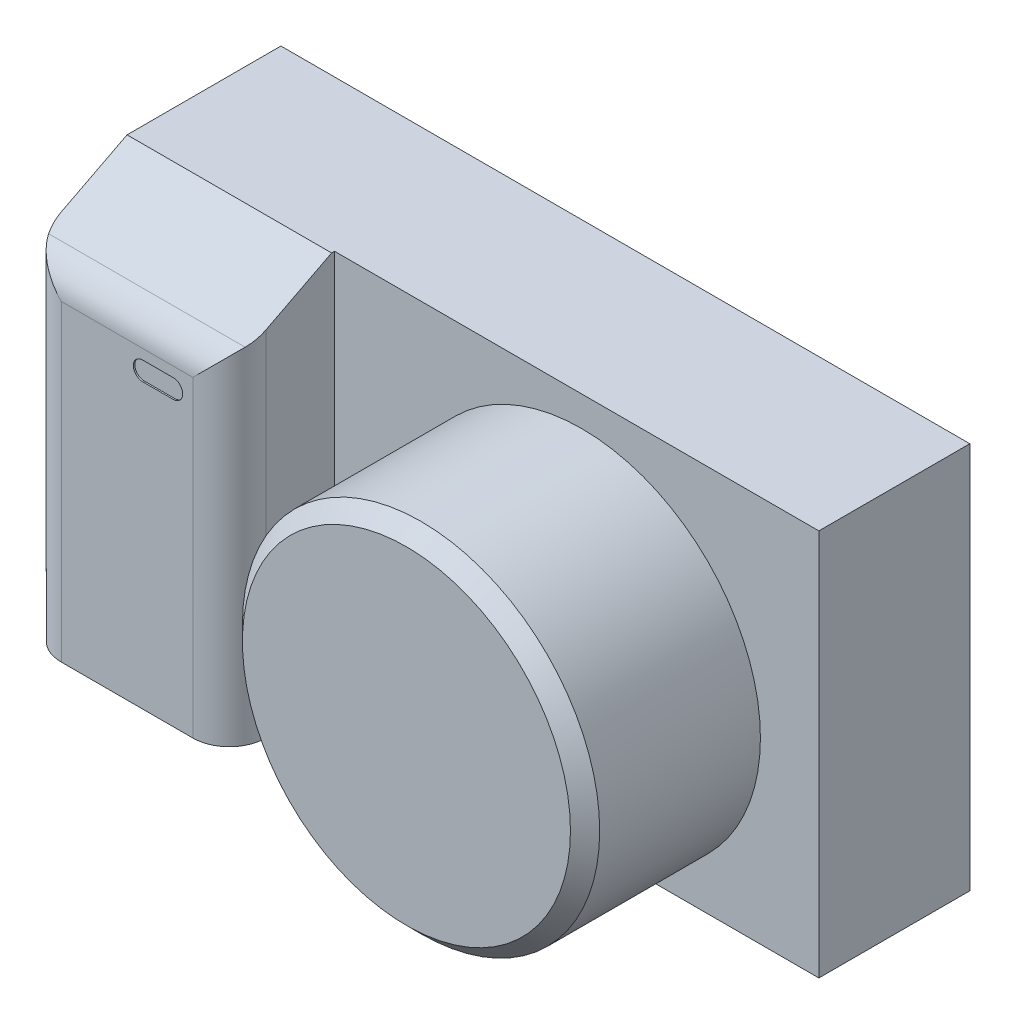
from build123d import *

# Parameters (mm, degrees)
SKETCH1_W                   = 119.7483
SKETCH1_H                   = 67.31
BOSS_EXTRUDE1_DEPTH         = 26.2382
SKETCH2_R                   = 31.0515
BOSS_EXTRUDE2_DEPTH         = 30.48
CHAMFER1_SIZE               = 2.54
SKETCH3_W                   = 35.56
SKETCH3_H                   = 67.31
BOSS_EXTRUDE3_DEPTH         = 18.288
CHAMFER2_SIZE               = 17.78
CHAMFER2_SIZE2              = 9.144
FILLET1_R                   = 6.35
CUT_EXTRUDE1_DEPTH          = 0.254
F_1_4_20_TAPPED_HOLE1_D     = 5.1054
F_1_4_20_TAPPED_HOLE1_DEPTH = 16.51
F_1_4_20_TAPPED_HOLE1_TIP   = 1.533816902


with BuildPart() as part:
    # Sketch1 → Boss-Extrude1 (new body)
    with BuildSketch(Plane.XY):
        Rectangle(SKETCH1_W, SKETCH1_H)
    extrude(amount=BOSS_EXTRUDE1_DEPTH)

    # Sketch2 → Boss-Extrude2 (add)
    with BuildSketch(Plane.XY.offset(26.2382)):
        with Locations(Location((18.66265, -2.6035, 0), (0, 0, 270))):
            Circle(SKETCH2_R)
    extrude(amount=BOSS_EXTRUDE2_DEPTH)

    # Chamfer1
    chamfer1_edges = [part.edges().sort_by_distance(p)[0] for p in [
        (18.66265, 28.448, 56.7182),
    ]]
    chamfer(chamfer1_edges, length=CHAMFER1_SIZE)

    # Sketch3 → Boss-Extrude3 (add)
    with BuildSketch(Plane.XY.offset(26.2382)):
        with Locations((-42.09415, 0)):
            Rectangle(SKETCH3_W, SKETCH3_H)
    extrude(amount=BOSS_EXTRUDE3_DEPTH)

    # Chamfer2
    chamfer2_edges = [part.edges().sort_by_distance(p)[0] for p in [
        (-42.09415, 33.655, 44.5262),
    ]]
    chamfer2_side = [part.faces().sort_by_distance(p)[0] for p in [
        (-7.218498902, 33.655, 16.936879024),
    ]]
    chamfer(chamfer2_edges, length=CHAMFER2_SIZE, length2=CHAMFER2_SIZE2, reference=chamfer2_side[0])

    # Fillet1
    fillet1_edges = [part.edges().sort_by_distance(p)[0] for p in [
        (-24.31415, -4.572, 44.5262),
        (-59.87415, -4.572, 44.5262),
        (-42.09415, 24.511, 44.5262),
    ]]
    fillet(fillet1_edges, radius=FILLET1_R)

    # Sketch4 → Cut-Extrude1 (cut)
    with BuildSketch(Plane.XY.offset(44.5262)):
        with BuildLine():
            Line((-39.36365, 18.892871189), (-34.063036375, 18.892871189))
            ThreePointArc((-34.063036375, 18.892871189), (-32.427100781, 17.256935594), (-34.063036375, 15.621))
            Line((-34.063036375, 15.621), (-39.36365, 15.621))
            ThreePointArc((-39.36365, 15.621), (-40.999585594, 17.256935594), (-39.36365, 18.892871189))
        make_face()
    extrude(amount=-CUT_EXTRUDE1_DEPTH, mode=Mode.SUBTRACT)

    # 1/4-20 Tapped Hole1
    with Locations(Plane(origin=(0, -33.655, 0), x_dir=(-1, 0, 0), z_dir=(0, -1, 0))):
        with Locations((-19.74215, -13.462)):
            Hole(F_1_4_20_TAPPED_HOLE1_D / 2, depth=F_1_4_20_TAPPED_HOLE1_DEPTH)
            with Locations((0, 0, -(F_1_4_20_TAPPED_HOLE1_DEPTH + F_1_4_20_TAPPED_HOLE1_TIP / 2))):  # 118° drill point
                Cone(0, F_1_4_20_TAPPED_HOLE1_D / 2, F_1_4_20_TAPPED_HOLE1_TIP, mode=Mode.SUBTRACT)


solid = part.part
